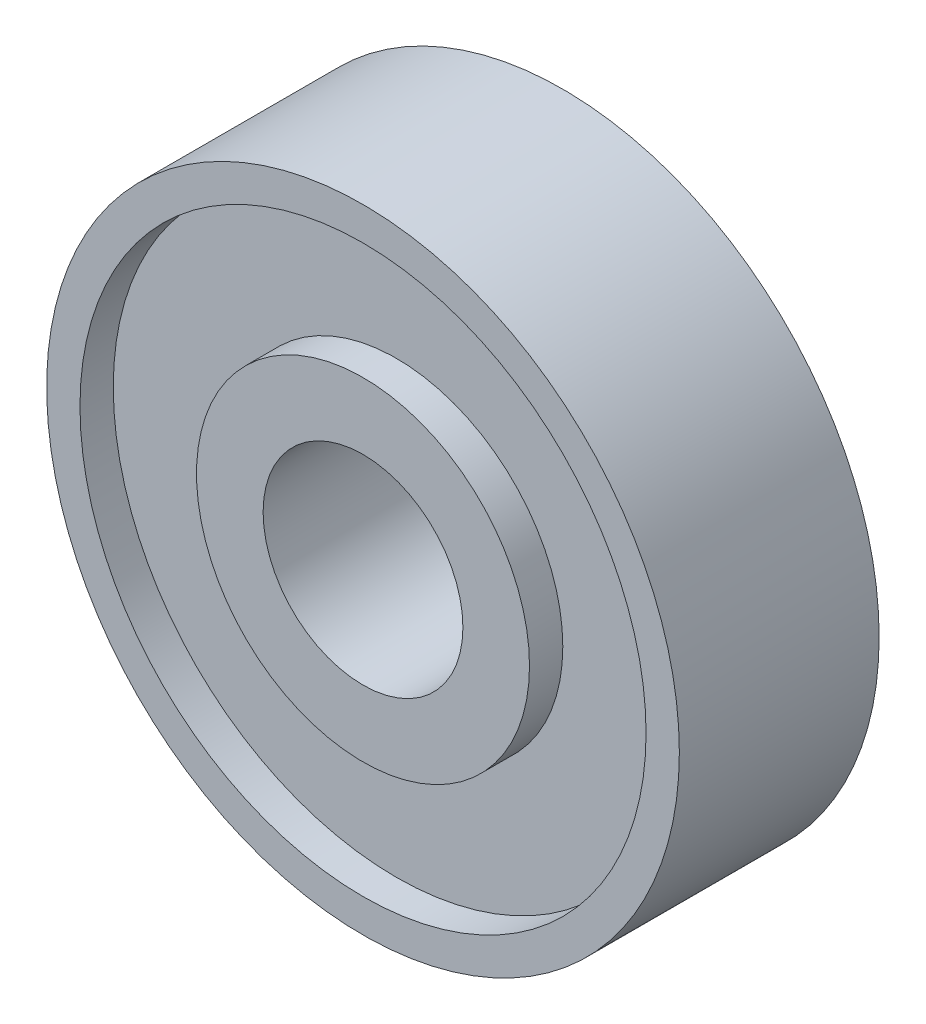
from build123d import *

# Parameters (mm, degrees)
SKETCH_1_R          = 9.5
EXTRUDE_1_DEPTH     = 6
SKETCH_2_R          = 8.5
CUT_EXTRUDE_1_DEPTH = 1
CUT_EXTRUDE_START   = -1
SKETCH_3_R          = 8.5
CUT_EXTRUDE_2_DEPTH = 1
SKETCH_4_R          = 5
EXTRUDE_4_DEPTH     = 1
EXTRUDE_START       = 1
SKETCH_6_R          = 5
EXTRUDE_5_DEPTH     = 1
SKETCH_7_R          = 3
CUT_EXTRUDE_3_DEPTH = 6


with BuildPart() as part:
    # 스케치1 → 돌출1 (new body)
    with BuildSketch(Plane.XY):
        Circle(SKETCH_1_R)
    extrude(amount=EXTRUDE_1_DEPTH)

    # 스케치2 → 컷-돌출1 (cut)
    with BuildSketch(Plane.XY.offset(6)):
        Circle(SKETCH_2_R)
    extrude(amount=-CUT_EXTRUDE_1_DEPTH, mode=Mode.SUBTRACT)

    # 스케치3 → 컷-돌출2 (cut)
    with BuildSketch(Plane(origin=(0, 0, 0), x_dir=(-1, 0, 0), z_dir=(0, 0, -1)).offset(CUT_EXTRUDE_START)):
        with Locations(Location((0, 0, 0), (0, 0, 180))):
            Circle(SKETCH_3_R)
    extrude(amount=CUT_EXTRUDE_2_DEPTH, mode=Mode.SUBTRACT)

    # 스케치4 → 돌출4 (add)
    with BuildSketch(Plane.XY.offset(5)):
        Circle(SKETCH_4_R)
    extrude(amount=EXTRUDE_4_DEPTH)

    # 스케치6 → 돌출5 (add)
    with BuildSketch(Plane(origin=(0, 0, 1), x_dir=(-1, 0, 0), z_dir=(0, 0, -1)).offset(EXTRUDE_START)):
        with Locations(Location((0, 0, 0), (0, 0, 180))):
            Circle(SKETCH_6_R)
    extrude(amount=-EXTRUDE_5_DEPTH)

    # 스케치7 → 컷-돌출3 (cut)
    with BuildSketch(Plane.XY.offset(6)):
        Circle(SKETCH_7_R)
    extrude(amount=-CUT_EXTRUDE_3_DEPTH, mode=Mode.SUBTRACT)


solid = part.part
